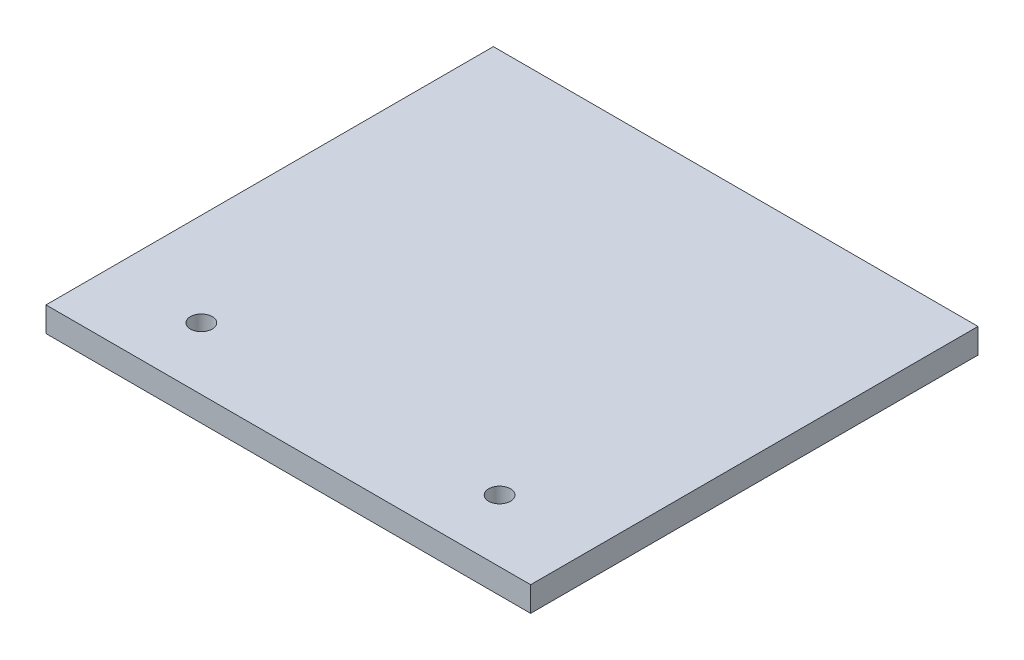
from build123d import *

# Parameters (mm, degrees)
SKETCH1_W               = 78
SKETCH1_H               = 72
SKETCH1_R               = 1.75
TRAY_BASE_EXTRUDE_DEPTH = 4


with BuildPart() as part:
    # Sketch1 → Tray_Base_Extrude (new body)
    with BuildSketch(Plane(origin=(0, 0, 0), x_dir=(1, 0, 0), z_dir=(0, 1, 0))):
        Rectangle(SKETCH1_W, SKETCH1_H)
        with Locations(Location((-24, -26, 0), (0, 0, 270))):
            Circle(SKETCH1_R, mode=Mode.SUBTRACT)
        with Locations(Location((24, -26, 0), (0, 0, 270))):
            Circle(SKETCH1_R, mode=Mode.SUBTRACT)
    extrude(amount=TRAY_BASE_EXTRUDE_DEPTH)


solid = part.part
